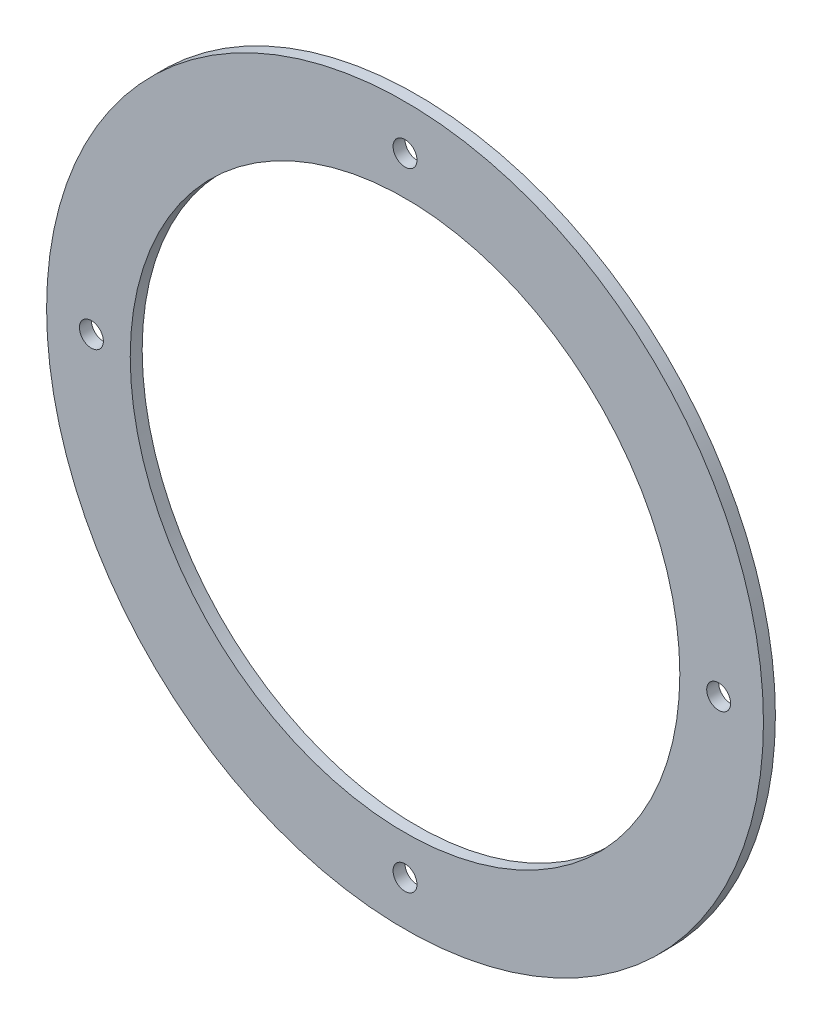
from build123d import *

# Parameters (mm, degrees)
SKETCH_1_R          = 75
SKETCH_1_R_2        = 2
SKETCH_1_R_3        = 46
EXTRUDE_1_DEPTH     = 2
SKETCH_2_R          = 1.5
CUT_EXTRUDE_1_DEPTH = 2
SKETCH_4_OUTSIDE_W  = 194.428
SKETCH_4_OUTSIDE_H  = 194.428
SKETCH_4_OUTSIDE_R  = 60
CUT_EXTRUDE_2_DEPTH = 10


with BuildPart() as part:
    # 草图1 → 凸台-拉伸1 (new body)
    with BuildSketch(Plane.XY):
        Circle(SKETCH_1_R)
        with Locations((-52.5, 0)):
            Circle(SKETCH_1_R_2, mode=Mode.SUBTRACT)
        with Locations((0, 52.5)):
            Circle(SKETCH_1_R_2, mode=Mode.SUBTRACT)
        with Locations((52.5, 0)):
            Circle(SKETCH_1_R_2, mode=Mode.SUBTRACT)
        with Locations((0, -52.5)):
            Circle(SKETCH_1_R_2, mode=Mode.SUBTRACT)
        Circle(SKETCH_1_R_3, mode=Mode.SUBTRACT)
    extrude(amount=EXTRUDE_1_DEPTH)

    # 草图2 → 切除-拉伸1 (cut)
    with BuildSketch(Plane.XY.offset(2)):
        with Locations((0, 69)):
            Circle(SKETCH_2_R)
        with Locations((69, 0)):
            Circle(SKETCH_2_R)
        with Locations((0, -69)):
            Circle(SKETCH_2_R)
        with Locations((-69, 0)):
            Circle(SKETCH_2_R)
    extrude(amount=-CUT_EXTRUDE_1_DEPTH, mode=Mode.SUBTRACT)

    # 草图4 outside → 切除-拉伸2 (cut)
    with BuildSketch(Plane.XY.offset(2)):
        Rectangle(SKETCH_4_OUTSIDE_W, SKETCH_4_OUTSIDE_H)
        Circle(SKETCH_4_OUTSIDE_R, mode=Mode.SUBTRACT)
    extrude(amount=-CUT_EXTRUDE_2_DEPTH, mode=Mode.SUBTRACT)


solid = part.part
